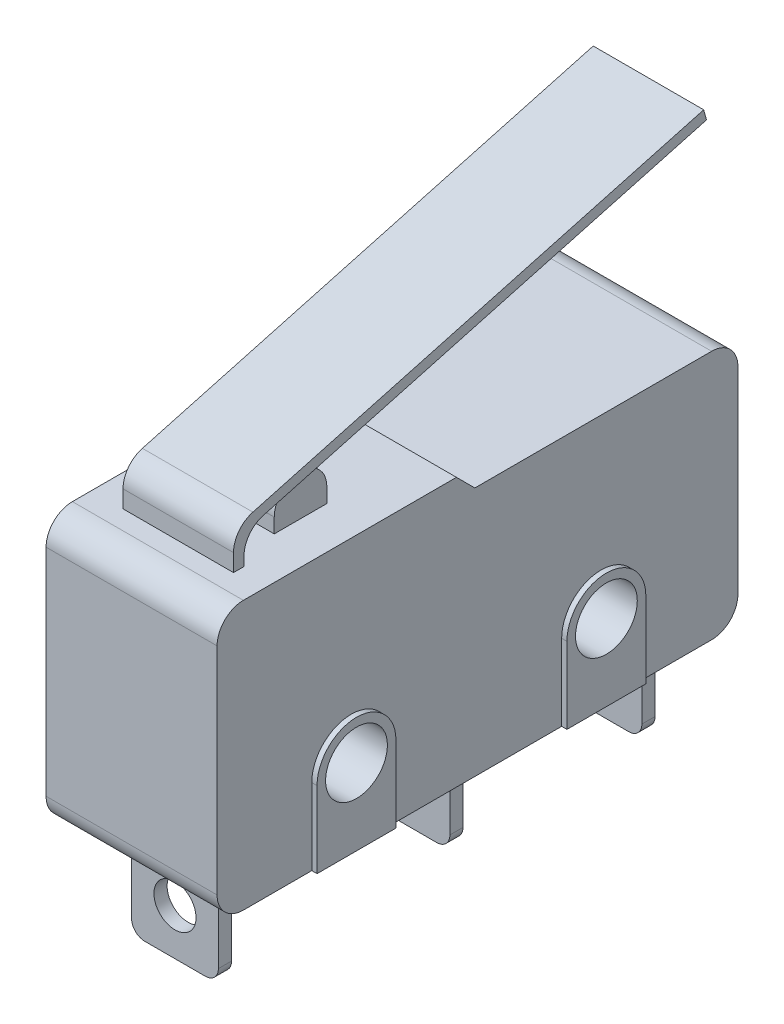
from build123d import *

# Parameters (mm, degrees)
EXTRUDE_1_DEPTH      = 3.2
EXTRUDE_1_DEPTH_BACK = 3.3
SKETCH_1_W           = 19.8
SKETCH_1_H           = 10.2
CUT_EXTRUDE_1_DEPTH  = 13.894572502
FILLET_1_R           = 1
EXTRUDE_2_DEPTH      = 1.65
EXTRUDE_2_DEPTH_BACK = 1.65
SKETCH_4_W           = 0.5
SKETCH_4_H           = 3.5
FILLET_2_R           = 0.5
SKETCH_5_R           = 0.8
CUT_EXTRUDE_2_DEPTH  = 21.398284242
SKETCH_8_R           = 1.175
CUT_EXTRUDE_3_DEPTH  = 15.636256352
EXTRUDE_3_DEPTH      = 2.1
EXTRUDE_3_DEPTH_BACK = 2.1
EXTRUDE_5_DEPTH      = 1.6
EXTRUDE_5_DEPTH_BACK = 1.5
FILLET_3_R           = 1
EXTRUDE_START        = 0.2
SKETCH_9_R           = 1.175
EXTRUDE_6_DEPTH      = 0.2


with BuildPart() as part:
    # 草图1 → 凸台-拉伸1 (new, two sides: drawn at the far end of the back side and taken through both)
    with BuildSketch(Plane(origin=(0, 0, 0), x_dir=(0, 0, -1), z_dir=(1, 0, 0)).offset(-EXTRUDE_1_DEPTH_BACK)):
        Rectangle(SKETCH_1_W, SKETCH_1_H)
    extrude(amount=EXTRUDE_1_DEPTH + EXTRUDE_1_DEPTH_BACK)

    # 草图2 → 切除-拉伸1 (cut, through all)
    with BuildSketch(Plane(origin=(3.2, 0, 0), x_dir=(0, 0, -1), z_dir=(1, 0, 0))):
        Polygon((-0.8, 5.1), (-0.1, 4.4), (9.9, 4.4), (9.9, 5.1), align=None)
    extrude(amount=-CUT_EXTRUDE_1_DEPTH, mode=Mode.SUBTRACT)

    # 圆角1
    fillet_1_edges = [part.edges().sort_by_distance(p)[0] for p in [
        (-0.05, 4.4, -9.9),
        (-0.05, -5.1, -9.9),
        (-0.05, -5.1, 9.9),
        (-0.05, 5.1, 9.9),
    ]]
    fillet(fillet_1_edges, radius=FILLET_1_R)

    # 草图4 → 凸台-拉伸2 (add, two sides: drawn at the far end of the back side and taken through both)
    with BuildSketch(Plane(origin=(0, 0, 0), x_dir=(0, 0, -1), z_dir=(1, 0, 0)).offset(-EXTRUDE_2_DEPTH_BACK)):
        with Locations((-8.05, -6.85)):
            Rectangle(SKETCH_4_W, SKETCH_4_H)
        with Locations((0.75, -6.85)):
            Rectangle(SKETCH_4_W, SKETCH_4_H)
        with Locations((8.05, -6.85)):
            Rectangle(SKETCH_4_W, SKETCH_4_H)
    extrude(amount=EXTRUDE_2_DEPTH + EXTRUDE_2_DEPTH_BACK)

    # 圆角2
    fillet_2_edges = [part.edges().sort_by_distance(p)[0] for p in [
        (-1.65, -8.6, 8.05),
        (1.65, -8.6, 8.05),
        (-1.65, -8.6, -0.75),
        (1.65, -8.6, -0.75),
        (1.65, -8.6, -8.05),
        (-1.65, -8.6, -8.05),
    ]]
    fillet(fillet_2_edges, radius=FILLET_2_R)

    # 草图5 → 切除-拉伸2 (cut, through all)
    with BuildSketch(Plane.XY.offset(8.3)):
        with Locations(Location((0, -6.85, 0), (0, 0, 270))):
            Circle(SKETCH_5_R)
    extrude(amount=-CUT_EXTRUDE_2_DEPTH, mode=Mode.SUBTRACT)

    # 草图8 → 切除-拉伸3 (cut, through all)
    with BuildSketch(Plane(origin=(3.2, 0, 0), x_dir=(0, 0, -1), z_dir=(1, 0, 0))):
        with Locations((-4.8, -2.2)):
            Circle(SKETCH_8_R)
        with Locations((4.7, -2.2)):
            Circle(SKETCH_8_R)
    extrude(amount=-CUT_EXTRUDE_3_DEPTH, mode=Mode.SUBTRACT)

    # 草图6 → 凸台-拉伸3 (add, two sides: drawn at the far end of the back side and taken through both)
    with BuildSketch(Plane(origin=(0, 0, 0), x_dir=(0, 0, -1), z_dir=(1, 0, 0)).offset(-EXTRUDE_3_DEPTH_BACK)):
        Polygon((-7.775241221, 6.217237719), (9.805291462, 11.014106611), (9.7, 11.4), (-8.175241221, 6.52271954), (-8.175241221, 5.1), (-7.775241221, 5.1), align=None)
    extrude(amount=EXTRUDE_3_DEPTH + EXTRUDE_3_DEPTH_BACK)

    # 草图7 → 凸台-拉伸5 (add, two sides: drawn at the far end of the back side and taken through both)
    with BuildSketch(Plane(origin=(0, 0, 0), x_dir=(0, 0, -1), z_dir=(1, 0, 0)).offset(-EXTRUDE_5_DEPTH_BACK)):
        with BuildLine():
            Line((-4.126745085, 5.653223192), (-4.126745085, 5.1))
            Line((-4.126745085, 5.1), (-6.126745085, 5.1))
            Line((-6.126745085, 5.1), (-6.126745085, 5.653223192))
            ThreePointArc((-6.126745085, 5.653223192), (-5.126745085, 6.653223192), (-4.126745085, 5.653223192))
        make_face()
    extrude(amount=EXTRUDE_5_DEPTH + EXTRUDE_5_DEPTH_BACK)

    # 圆角3
    fillet_3_edges = [part.edges().sort_by_distance(p)[0] for p in [
        (0, 6.217237719, 7.775241221),
        (0, 6.52271954, 8.175241221),
    ]]
    fillet(fillet_3_edges, radius=FILLET_3_R)

    # 草图9 → 凸台-拉伸6 (add)
    # profile 1 of 2: a face of its own
    with BuildSketch(Plane(origin=(3.2, 0, 0), x_dir=(0, 0, -1), z_dir=(1, 0, 0)).offset(EXTRUDE_START)):
        with BuildLine():
            Line((-3.3, -2.2), (-3.3, -5.1))
            Line((-3.3, -5.1), (-6.3, -5.1))
            Line((-6.3, -5.1), (-6.3, -2.2))
            ThreePointArc((-6.3, -2.2), (-4.8, -0.7), (-3.3, -2.2))
        make_face()
        with Locations((-4.8, -2.2)):
            Circle(SKETCH_9_R, mode=Mode.SUBTRACT)
    # profile 2 of 2: a face of its own
    with BuildSketch(Plane(origin=(3.2, 0, 0), x_dir=(0, 0, -1), z_dir=(1, 0, 0)).offset(EXTRUDE_START)):
        with BuildLine():
            Line((3.2, -2.2), (3.2, -5.1))
            Line((3.2, -5.1), (6.2, -5.1))
            Line((6.2, -5.1), (6.2, -2.2))
            ThreePointArc((6.2, -2.2), (4.7, -0.7), (3.2, -2.2))
        make_face()
        with Locations((4.7, -2.2)):
            Circle(SKETCH_9_R, mode=Mode.SUBTRACT)
    extrude_6 = extrude(amount=-EXTRUDE_6_DEPTH)

    # 镜向1: 凸台-拉伸6 across plane
    add(extrude_6.mirror(Plane(origin=(0, 0, 0), x_dir=(0, 0, 1), z_dir=(1, 0, 0))))


solid = part.part
